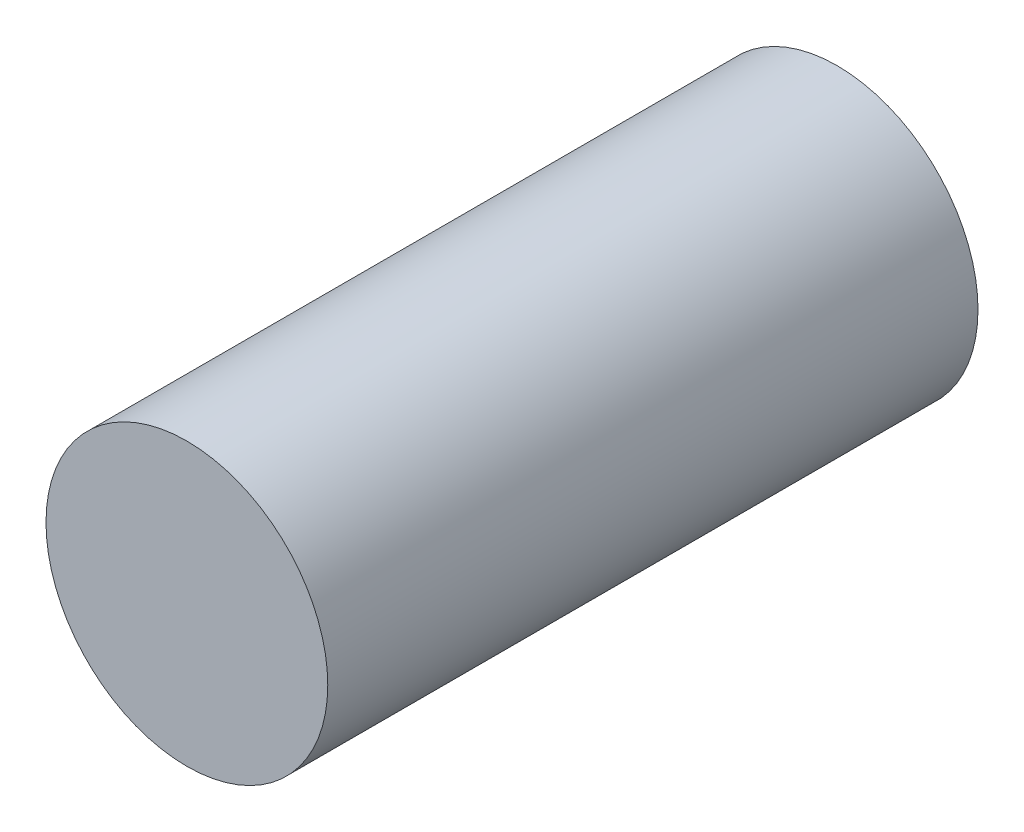
from build123d import *

# Parameters (mm, degrees)
SKETCH1_R           = 32.5
BOSS_EXTRUDE1_DEPTH = 150


with BuildPart() as part:
    # Sketch1 → Boss-Extrude1 (new body)
    with BuildSketch(Plane.XY):
        Circle(SKETCH1_R)
    extrude(amount=BOSS_EXTRUDE1_DEPTH)


solid = part.part
